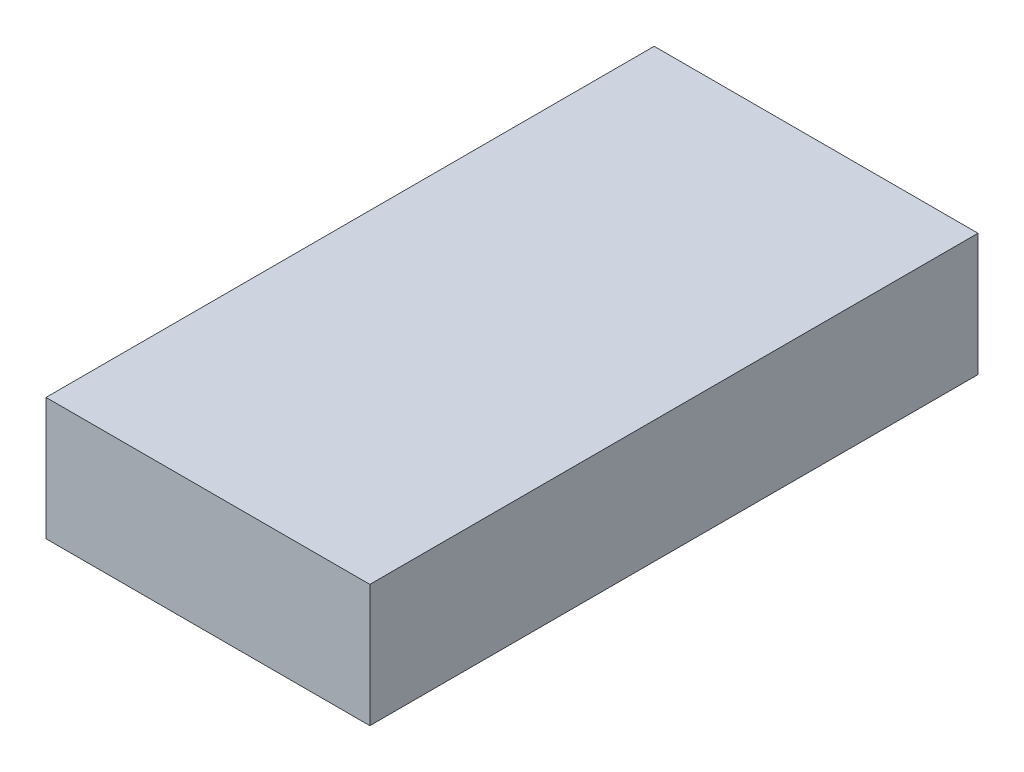
from build123d import *

# Parameters (mm, degrees)
SKETCH1_W           = 77
SKETCH1_H           = 15.5
BOSS_EXTRUDE1_DEPTH = 41


with BuildPart() as part:
    # Sketch1 → Boss-Extrude1 (new body)
    with BuildSketch(Plane(origin=(0, 0, 0), x_dir=(0, 0, -1), z_dir=(1, 0, 0))):
        with Locations((38.5, 7.75)):
            Rectangle(SKETCH1_W, SKETCH1_H)
    extrude(amount=BOSS_EXTRUDE1_DEPTH)


solid = part.part
